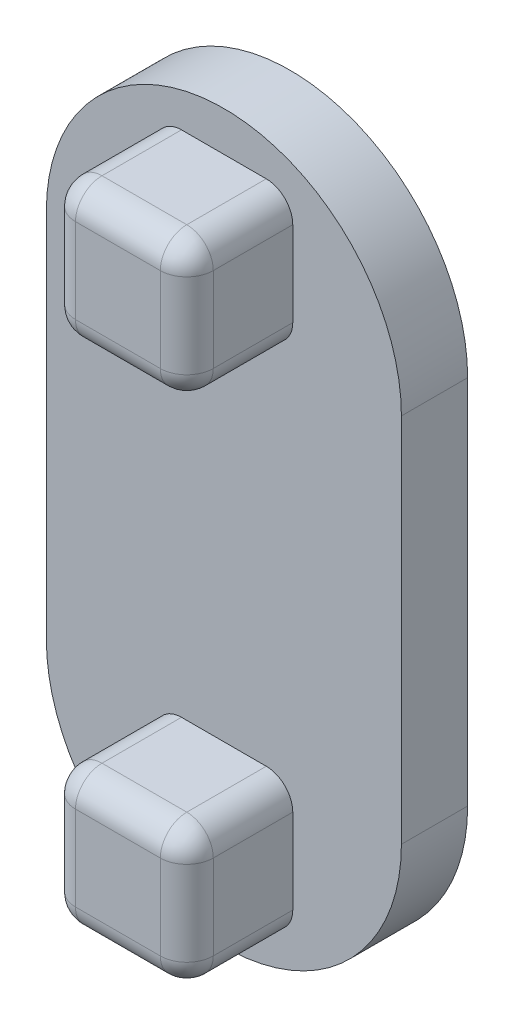
from build123d import *

# Parameters (mm, degrees)
BOSS_EXTRUDE1_DEPTH = 2.5
SKETCH2_W           = 5.2
SKETCH2_H           = 5.2
BOSS_EXTRUDE2_DEPTH = 4
FILLET1_R           = 1


with BuildPart() as part:
    # Sketch1 → Boss-Extrude1 (new body)
    with BuildSketch(Plane(origin=(0, 0, 0), x_dir=(0, 1, 0), z_dir=(0, 0, 1))):
        with BuildLine():
            Line((0, 6.7), (14, 6.7))
            ThreePointArc((14, 6.7), (20.7, 0), (14, -6.7))
            Line((14, -6.7), (0, -6.7))
            ThreePointArc((0, -6.7), (-6.7, 0), (0, 6.7))
        make_face()
    extrude(amount=BOSS_EXTRUDE1_DEPTH)

    # Sketch2 → Boss-Extrude2 (add)
    with BuildSketch(Plane.XY.offset(2.5)):
        with Locations((0, -2.6)):
            Rectangle(SKETCH2_W, SKETCH2_H)
        with Locations((0, 16.6)):
            Rectangle(SKETCH2_W, SKETCH2_H)
    extrude(amount=BOSS_EXTRUDE2_DEPTH)

    # Fillet1
    fillet1_edges = [part.edges().sort_by_distance(p)[0] for p in [
        (-2.6, 0, 4.5),
        (-2.6, -5.2, 4.5),
        (2.6, -5.2, 4.5),
        (2.6, 0, 4.5),
        (-2.6, -2.6, 6.5),
        (0, -5.2, 6.5),
        (2.6, -2.6, 6.5),
        (0, 0, 6.5),
        (-2.6, 14, 4.5),
        (2.6, 14, 4.5),
        (2.6, 19.2, 4.5),
        (-2.6, 19.2, 4.5),
        (0, 14, 6.5),
        (2.6, 16.6, 6.5),
        (0, 19.2, 6.5),
        (-2.6, 16.6, 6.5),
    ]]
    fillet(fillet1_edges, radius=FILLET1_R)


solid = part.part
